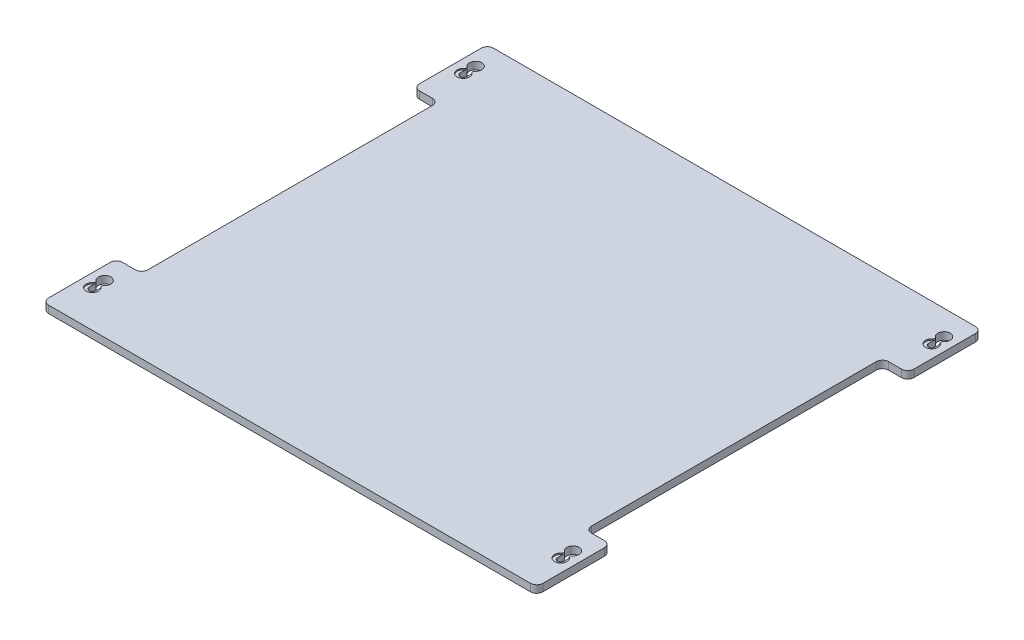
from build123d import *

# Parameters (mm, degrees)
BOSS_EXTRUDE1_DEPTH = 6
CUT_EXTRUDE1_DEPTH  = 270.845326067
SKETCH3_R           = 5
CUT_EXTRUDE2_DEPTH  = 1
FILLET1_R           = 5


with BuildPart() as part:
    # Sketch1 → Boss-Extrude1 (new body)
    with BuildSketch(Plane(origin=(0, 0, 0), x_dir=(1, 0, 0), z_dir=(0, 1, 0))):
        Polygon((0, -180.5), (200.5, -180.5), (200.5, -120.5), (180, -120.5), (180, 0), (180, 120.5), (200.5, 120.5), (200.5, 180.5), (0, 180.5), (-200.5, 180.5), (-200.5, 120.5), (-180, 120.5), (-180, 0), (-180, -120.5), (-200.5, -120.5), (-200.5, -180.5), align=None)
    extrude(amount=BOSS_EXTRUDE1_DEPTH)

    # Sketch2 → Cut-Extrude1 (cut, through all)
    with BuildSketch(Plane(origin=(0, 6, 0), x_dir=(1, 0, 0), z_dir=(0, 1, 0))):
        with BuildLine():
            Line((187.4, -150.5), (187.4, -144.770831301))
            ThreePointArc((187.4, -144.770831301), (190, -135.5), (192.6, -144.770831301))
            Line((192.6, -144.770831301), (192.6, -150.5))
            ThreePointArc((192.6, -150.5), (190, -153.1), (187.4, -150.5))
        make_face()
        with BuildLine():
            Line((187.4, 150.5), (187.4, 156.229168699))
            ThreePointArc((187.4, 156.229168699), (190, 165.5), (192.6, 156.229168699))
            Line((192.6, 156.229168699), (192.6, 150.5))
            ThreePointArc((192.6, 150.5), (190, 147.9), (187.4, 150.5))
        make_face()
    cut_extrude1 = extrude(amount=-CUT_EXTRUDE1_DEPTH, mode=Mode.SUBTRACT)

    # Sketch3 → Cut-Extrude2 (cut)
    with BuildSketch(Plane(origin=(0, 6, 0), x_dir=(1, 0, 0), z_dir=(0, 1, 0))):
        with Locations((190, 150.5)):
            Circle(SKETCH3_R)
        with Locations((190, -150.5)):
            Circle(SKETCH3_R)
    cut_extrude2 = extrude(amount=-CUT_EXTRUDE2_DEPTH, mode=Mode.SUBTRACT)

    # Mirror1: Cut-Extrude1, Cut-Extrude2 across plane
    add(cut_extrude1.mirror(Plane(origin=(0, 0, 0), x_dir=(0, 0, 1), z_dir=(1, 0, 0))), mode=Mode.SUBTRACT)
    add(cut_extrude2.mirror(Plane(origin=(0, 0, 0), x_dir=(0, 0, 1), z_dir=(1, 0, 0))), mode=Mode.SUBTRACT)

    # Fillet1
    fillet1_edges = [part.edges().sort_by_distance(p)[0] for p in [
        (-200.5, 3, 180.5),
        (-200.5, 3, 120.5),
        (-180, 3, 120.5),
        (-180, 3, -120.5),
        (-200.5, 3, -120.5),
        (-200.5, 3, -180.5),
        (200.5, 3, -180.5),
        (200.5, 3, -120.5),
        (180, 3, -120.5),
        (180, 3, 120.5),
        (200.5, 3, 120.5),
        (200.5, 3, 180.5),
    ]]
    fillet(fillet1_edges, radius=FILLET1_R)


solid = part.part
